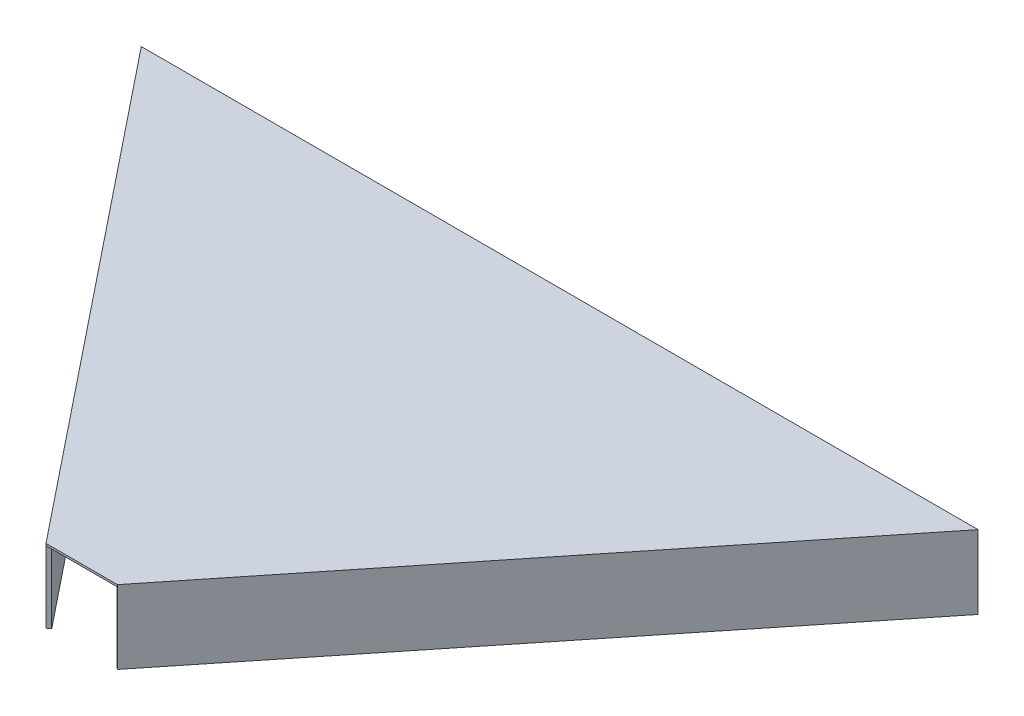
from build123d import *

# Parameters (mm, degrees)
BOSS_EXTRUDE1_DEPTH     = 35
CUT_EXTRUDE1_DEPTH      = 314.199217751
CUT_EXTRUDE1_DEPTH_BACK = 314.199217751
SKETCH2_W               = 401.672921909
SKETCH2_H               = 2
BOSS_EXTRUDE2_DEPTH     = 1


with BuildPart() as part:
    # Sketch1 → Boss-Extrude1 (new body)
    with BuildSketch(Plane(origin=(0, 0, 0), x_dir=(1, 0, 0), z_dir=(0, 1, 0))):
        Polygon((-205, 0), (205, 0), (17.5, -234.18742494), (15.9387505, -232.93742494), (200.836668001, -2), (-200.836668001, -2), (-15.9387505, -232.93742494), (-17.5, -234.18742494), align=None)
    extrude(amount=BOSS_EXTRUDE1_DEPTH)

    # Sketch2 → Cut-Extrude1 (cut, two sides: drawn at the far end of the back side and taken through both)
    with BuildSketch(Plane(origin=(0, 35, 0), x_dir=(1, 0, 0), z_dir=(0, 1, 0)).offset(-CUT_EXTRUDE1_DEPTH_BACK)):
        with Locations((-0.000207047, -1)):
            Rectangle(SKETCH2_W, SKETCH2_H)
    extrude(amount=CUT_EXTRUDE1_DEPTH + CUT_EXTRUDE1_DEPTH_BACK, mode=Mode.SUBTRACT)


with BuildPart() as cut_extrude1_piece_1:
    # of the separate pieces the step leaves, piece 1, a body of its own (cut_extrude1_pieces)
    add(part.part.solids().sort_by_distance((200.836253908, 0, 0))[0])



with BuildPart() as cut_extrude1_piece_2:
    # of the separate pieces the step leaves, piece 2, a body of its own (cut_extrude1_pieces)
    add(part.part.solids().sort_by_distance((-205, 0, 0))[0])


with BuildPart() as cut_extrude1_piece_1_1:
    add(cut_extrude1_piece_1.part)

    add(cut_extrude1_piece_2.part)  # Boss-Extrude2 merges Cut-Extrude1 piece 2
    # Sketch3 → Boss-Extrude2 (add)
    with BuildSketch(Plane(origin=(0, 35, 0), x_dir=(1, 0, 0), z_dir=(0, 1, 0))):
        Polygon((-205, 0), (-17.5, -234.18742494), (17.5, -234.18742494), (205, 0), align=None)
    extrude(amount=BOSS_EXTRUDE2_DEPTH)


solid = cut_extrude1_piece_1_1.part
